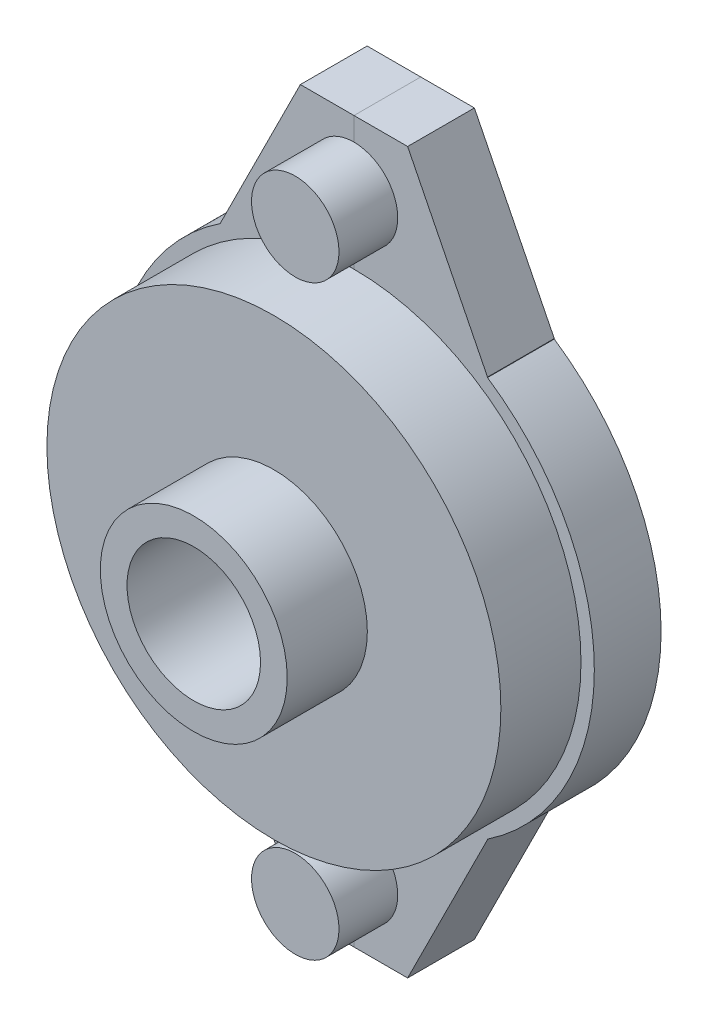
from build123d import *

# Parameters (mm, degrees)
SKETCH_1_R          = 17
EXTRUDE_1_DEPTH     = 6
SKETCH_2_R          = 7
EXTRUDE_2_DEPTH     = 6
SKETCH_3_R          = 18
EXTRUDE_3_DEPTH     = 5
EXTRUDE_START       = -5
EXTRUDE_6_DEPTH     = 5
CUT_EXTRUDE_1_DEPTH = 8
SKETCH_6_R          = 3.275
EXTRUDE_5_DEPTH     = 4.4
SKETCH_9_R          = 5
CUT_EXTRUDE_3_DEPTH = 37.608729958
SKETCH_10_R         = 13.6
SKETCH_10_R_2       = 8.6
CUT_EXTRUDE_4_DEPTH = 3
SKETCH_11_R         = 8.6
CUT_EXTRUDE_5_DEPTH = 2.8


with BuildPart() as part:
    # 스케치1 → 보스-돌출1 (new body)
    with BuildSketch(Plane.XY):
        Circle(SKETCH_1_R)
    extrude(amount=EXTRUDE_1_DEPTH)

    # 스케치2 → 보스-돌출2 (add)
    with BuildSketch(Plane.XY.offset(6)):
        Circle(SKETCH_2_R)
    extrude(amount=EXTRUDE_2_DEPTH)

    # 스케치3 → 보스-돌출3 (add)
    with BuildSketch(Plane(origin=(0, 0, 0), x_dir=(-1, 0, 0), z_dir=(0, 0, -1))):
        Circle(SKETCH_3_R)
    extrude(amount=EXTRUDE_3_DEPTH)

    # 스케치8 → 보스-돌출6 (add)
    with BuildSketch(Plane(origin=(0, 0, -5), x_dir=(-1, 0, 0), z_dir=(0, 0, -1)).offset(EXTRUDE_START)):
        with BuildLine():
            Line((-10, 14.966629547), (-10, 26.966629547))
            Line((-10, 26.966629547), (10, 26.966629547))
            Line((10, 26.966629547), (10, 14.966629547))
            ThreePointArc((10, 14.966629547), (0, 18), (-10, 14.966629547))
        make_face()
    extrude_6 = extrude(amount=EXTRUDE_6_DEPTH)

    # 스케치5 → 컷-돌출1 (cut)
    with BuildSketch(Plane.XY):
        Polygon((-10, 27), (-10, 15), (-4, 27), align=None)
        Polygon((4, 27), (10, 27), (10, 15), align=None)
    cut_extrude_1 = extrude(amount=-CUT_EXTRUDE_1_DEPTH, mode=Mode.SUBTRACT)

    # 스케치6 → 보스-돌출5 (add)
    with BuildSketch(Plane.XY):
        with Locations(Location((0, 21.966629547, 0), (0, 0, 180))):
            Circle(SKETCH_6_R)
    extrude_5 = extrude(amount=EXTRUDE_5_DEPTH)

    # 대칭 복사6: 보스-돌출6, 컷-돌출1, 보스-돌출5 across plane
    add(extrude_6.mirror(Plane.ZX))
    add(cut_extrude_1.mirror(Plane.ZX), mode=Mode.SUBTRACT)
    add(extrude_5.mirror(Plane.ZX))

    # 스케치9 → 컷-돌출3 (cut, through all)
    with BuildSketch(Plane.XY.offset(12)):
        Circle(SKETCH_9_R)
    extrude(amount=-CUT_EXTRUDE_3_DEPTH, mode=Mode.SUBTRACT)

    # 스케치10 → 컷-돌출4 (cut)
    with BuildSketch(Plane(origin=(0, 0, -5), x_dir=(-1, 0, 0), z_dir=(0, 0, -1))):
        Circle(SKETCH_10_R)
        Circle(SKETCH_10_R_2, mode=Mode.SUBTRACT)
    extrude(amount=-CUT_EXTRUDE_4_DEPTH, mode=Mode.SUBTRACT)

    # 스케치11 → 컷-돌출5 (cut)
    with BuildSketch(Plane(origin=(0, 0, -5), x_dir=(-1, 0, 0), z_dir=(0, 0, -1))):
        Circle(SKETCH_11_R)
    extrude(amount=-CUT_EXTRUDE_5_DEPTH, mode=Mode.SUBTRACT)


solid = part.part
